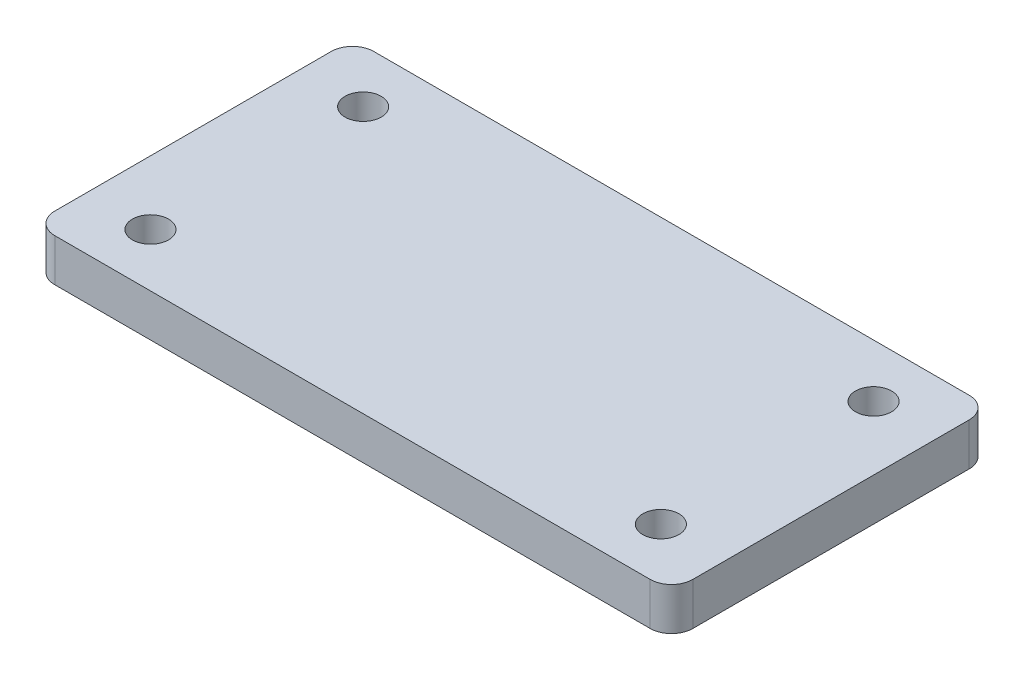
from build123d import *

# Parameters (mm, degrees)
SKETCH1_W                  = 300
SKETCH1_H                  = 150
BOSS_EXTRUDE1_DEPTH        = 20
FILLET1_R                  = 10
F_17_0_17_DIAMETER_HOLE1_D = 17


with BuildPart() as part:
    # Sketch1 → Boss-Extrude1 (new body)
    with BuildSketch(Plane(origin=(0, 0, 0), x_dir=(1, 0, 0), z_dir=(0, 1, 0))):
        Rectangle(SKETCH1_W, SKETCH1_H)
    extrude(amount=BOSS_EXTRUDE1_DEPTH)

    # Fillet1
    fillet1_edges = [part.edges().sort_by_distance(p)[0] for p in [
        (150, 10, 75),
        (-150, 10, 75),
        (-150, 10, -75),
        (150, 10, -75),
    ]]
    fillet(fillet1_edges, radius=FILLET1_R)

    # Ø17.0 (17) Diameter Hole1 (through all)
    with Locations(Plane(origin=(-120, 20, -50), x_dir=(0, 0, 1), z_dir=(0, 1, 0))):
        with Locations((0, 0), (100, 0), (0, 240), (100, 240)):
            Hole(F_17_0_17_DIAMETER_HOLE1_D / 2)


solid = part.part
